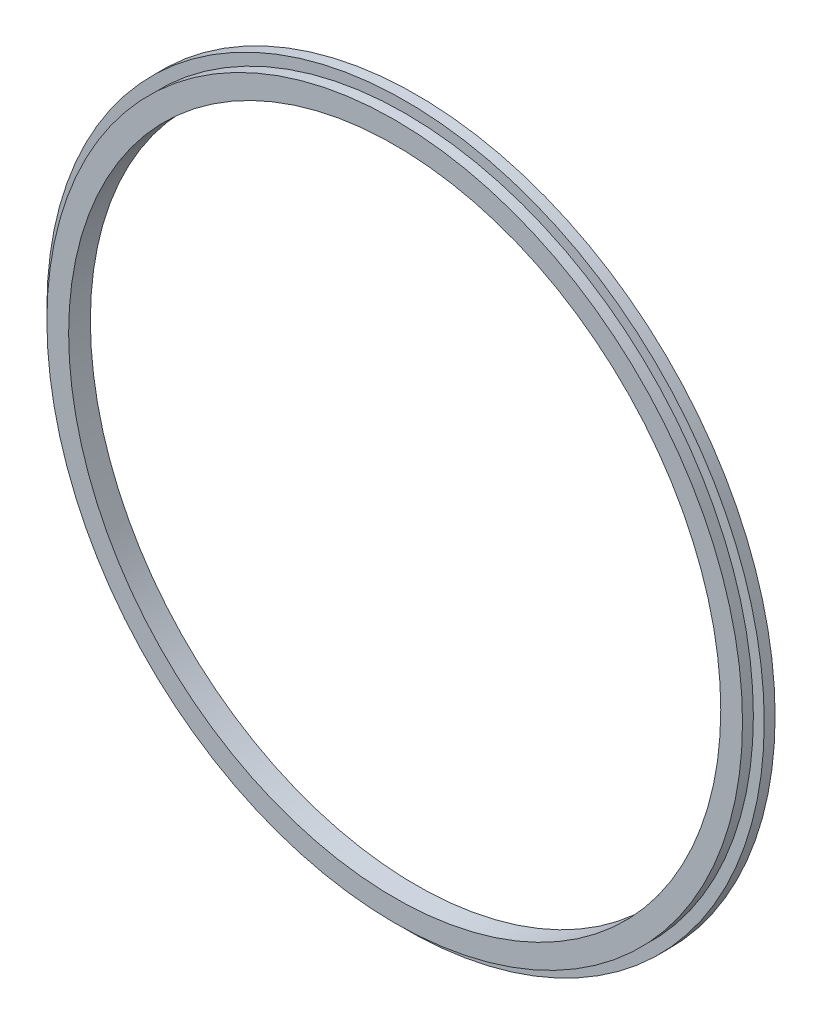
from build123d import *
from build123d.topology import SkipClean

# Parameters (mm, degrees)
SKETCH1_R           = 64
SKETCH1_R_2         = 60
BOSS_EXTRUDE1_DEPTH = 2
BOSS_EXTRUDE2_START = 2
SKETCH3_R           = 66
SKETCH3_R_2         = 60
BOSS_EXTRUDE2_DEPTH = 2


with BuildPart() as part:
    # Sketch1 → Boss-Extrude1 (new body)
    with BuildSketch(Plane.XY):
        Circle(SKETCH1_R)
        Circle(SKETCH1_R_2, mode=Mode.SUBTRACT)
    extrude(amount=BOSS_EXTRUDE1_DEPTH)

    # Sketch3 → Boss-Extrude2 (add)
    with SkipClean():  # the faces are left unmerged after this step: merging them gives an invalid solid
        with BuildSketch(Plane(origin=(0, 0, 0), x_dir=(-1, 0, 0), z_dir=(0, 0, -1)).offset(BOSS_EXTRUDE2_START)):
            Circle(SKETCH3_R)
            Circle(SKETCH3_R_2, mode=Mode.SUBTRACT)
        extrude(amount=-BOSS_EXTRUDE2_DEPTH)


solid = part.part
